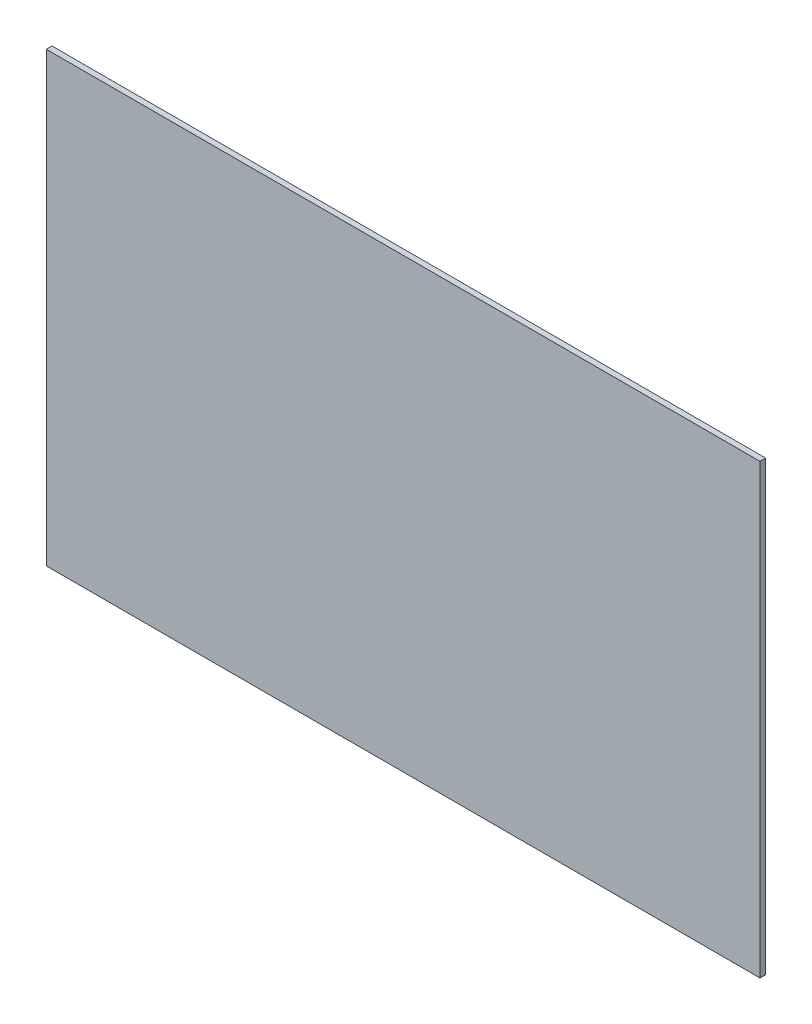
from build123d import *

# Parameters (mm, degrees)
SKETCH1_W           = 800.1
SKETCH1_H           = 501.65
BOSS_EXTRUDE1_DEPTH = 6.35


with BuildPart() as part:
    # Sketch1 → Boss-Extrude1 (new body)
    with BuildSketch(Plane.XY):
        Rectangle(SKETCH1_W, SKETCH1_H)
    extrude(amount=BOSS_EXTRUDE1_DEPTH)


solid = part.part
